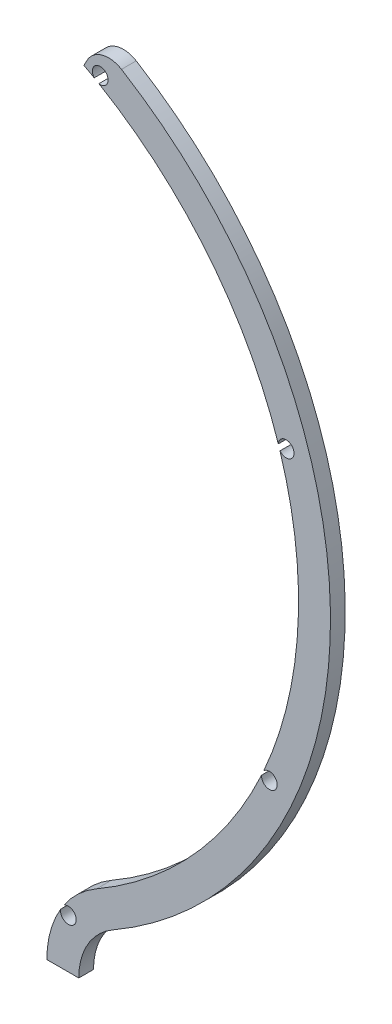
from build123d import *

# Parameters (mm, degrees)
BOSS_EXTRUDE1_DEPTH = 3


with BuildPart() as part:
    # Sketch1 → Boss-Extrude1 (new body)
    with BuildSketch(Plane.XY):
        with BuildLine():
            ThreePointArc((33.820087007, 10.306516907), (31.717745776, 5.342686157), (31, 0))
            Line((31, 0), (37.5, 0))
            ThreePointArc((37.5, 0), (39.341287437, 6.871778265), (44.371778265, 11.902269093))
            ThreePointArc((44.371778265, 11.902269093), (88.737214743, 87.695526288), (46.196526291, 164.52780867))
            ThreePointArc((46.196526291, 164.52780867), (42.270857001, 165.080519331), (39.176809364, 162.60196377))
            Line((39.176809364, 162.60196377), (38.543843383, 161.408867573))
            ThreePointArc((38.543843383, 161.408867573), (39.597624954, 160.839941503), (40.643010869, 160.255731986))
            ThreePointArc((40.643010869, 160.255731986), (41.32681397, 162.784822546), (43.471778265, 161.280490828))
            ThreePointArc((43.471778265, 161.280490828), (42.902085601, 160.056372046), (41.598694773, 159.703967626))
            ThreePointArc((41.598694773, 159.703967626), (63.992298043, 140.41869644), (78.122959048, 114.462587877))
            ThreePointArc((78.122959048, 114.462587877), (79.754340696, 115.996827193), (81.321620809, 114.397161787))
            ThreePointArc((81.321620809, 114.397161787), (80.242557038, 112.884341426), (78.460839002, 113.41205812))
            ThreePointArc((78.460839002, 113.41205812), (82.110783268, 84.085055904), (75.158253764, 55.361241991))
            ThreePointArc((75.158253764, 55.361241991), (76.905197137, 55.720291583), (77.899174561, 54.239502389))
            ThreePointArc((77.899174561, 54.239502389), (76.240981534, 52.640560998), (74.703407596, 54.355811439))
            ThreePointArc((74.703407596, 54.355811439), (60.769047297, 33.338707308), (41.121778265, 17.531434218))
            ThreePointArc((41.121778265, 17.531434218), (37.422133199, 14.790870093), (34.437437632, 11.285209284))
            ThreePointArc((34.437437632, 11.285209284), (36.109888407, 11.429129733), (36.990452374, 10))
            ThreePointArc((36.990452374, 10), (35.236479303, 8.407425891), (33.820087007, 10.306516907))
        make_face()
    extrude(amount=BOSS_EXTRUDE1_DEPTH)


solid = part.part
